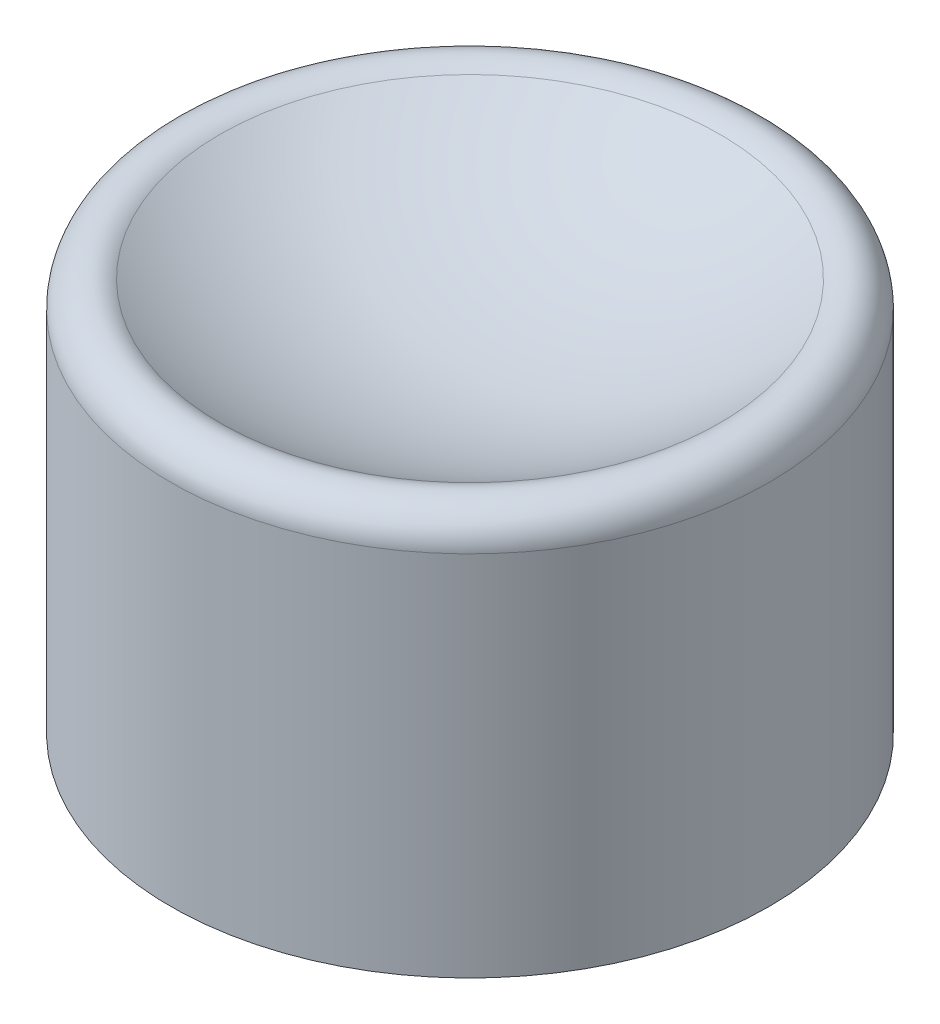
from build123d import *


with BuildPart() as part:
    # Sketch1 → Revolve1 (revolve)
    with BuildSketch(Plane.XY):
        with BuildLine():
            Line((-1.5494, 0), (-1.5494, 3.048))
            Line((-1.5494, 3.048), (-0.762, 3.048))
            Line((-0.762, 3.048), (-0.762, 4.064))
            Line((-0.762, 4.064), (0, 4.064))
            Line((0, 4.064), (0, 5.08))
            ThreePointArc((0, 5.08), (-2.074697908, 5.383049508), (-3.976029965, 6.266874616))
            ThreePointArc((-3.976029965, 6.266874616), (-4.495955195, 6.288948978), (-4.7625, 5.842))
            Line((-4.7625, 5.842), (-4.7625, 0))
            Line((-4.7625, 0), (-3.4925, 0))
            Line((-3.4925, 0), (-3.4925, 4.064))
            Line((-3.4925, 4.064), (-2.0574, 4.064))
            Line((-2.0574, 4.064), (-2.0574, 0))
            Line((-2.0574, 0), (-1.5494, 0))
        make_face()
    revolve(axis=Axis((0, 0, 0), (0, -1, 0)))


solid = part.part
